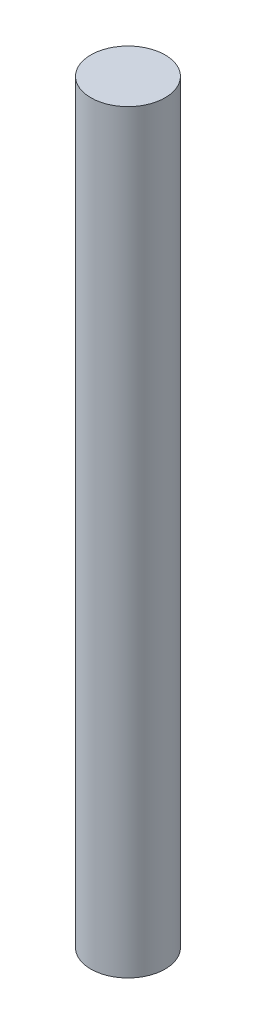
from build123d import *

# Parameters (mm, degrees)
SKETCH1_R           = 2.5
BOSS_EXTRUDE1_DEPTH = 50.8


with BuildPart() as part:
    # Sketch1 → Boss-Extrude1 (new body)
    with BuildSketch(Plane(origin=(0, 0, 0), x_dir=(1, 0, 0), z_dir=(0, 1, 0))):
        with Locations(Location((0, 0, 0), (0, 0, 270))):
            Circle(SKETCH1_R)
    extrude(amount=BOSS_EXTRUDE1_DEPTH)


solid = part.part
